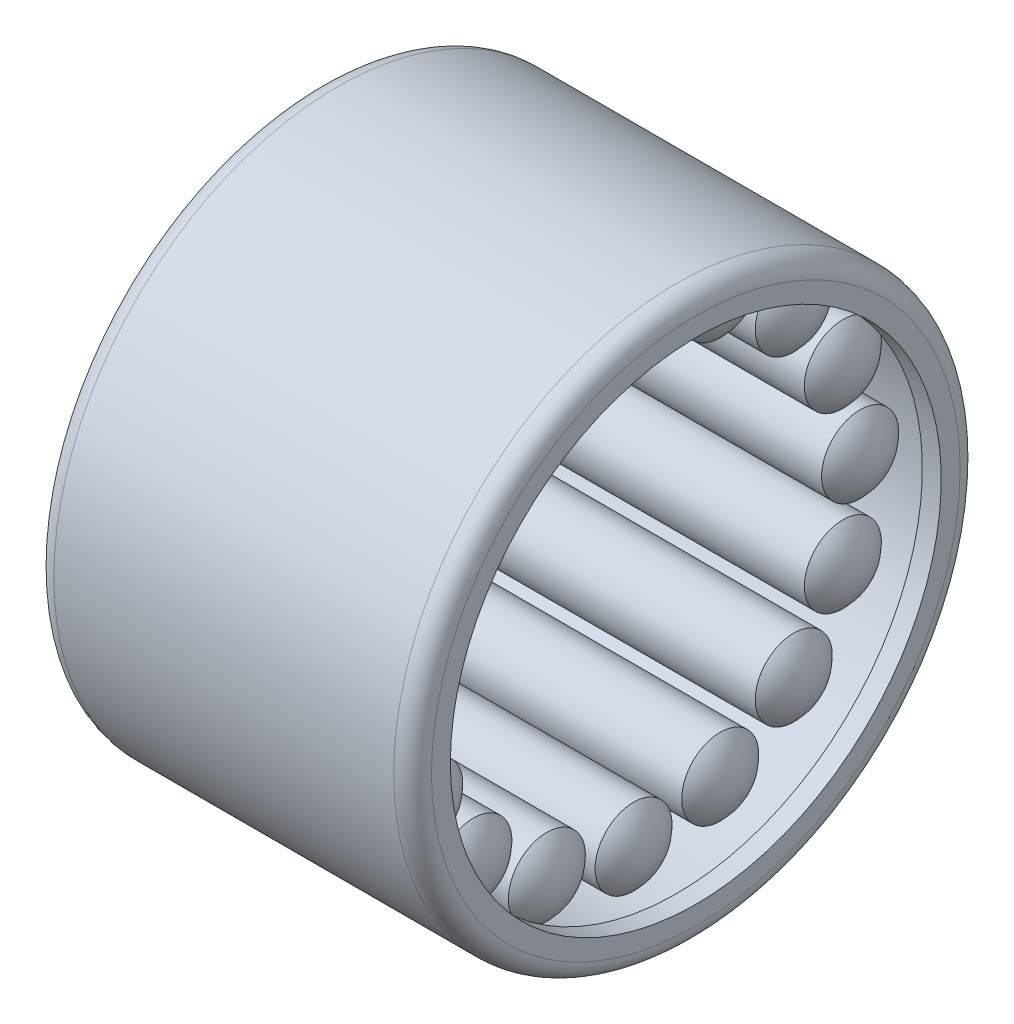
from build123d import *

# Parameters (mm, degrees)
R_P_TITION_CIRCULAIRE1_COUNT = 16


with BuildPart() as part:
    # Esquisse1 → Base-Révolution (revolve)
    with BuildSketch(Plane.XY, mode=Mode.PRIVATE) as base_r_volution_sk:
        with BuildLine():
            Line((0, 0), (0, 1))
            Line((0, 1), (-0.2, 1))
            Line((-0.2, 1), (-0.2, 4))
            Line((-0.2, 4), (0, 4))
            Line((0, 4), (0, 5.5))
            Line((0, 5.5), (-0.2, 5.5))
            Line((-0.2, 5.5), (-0.2, 7))
            ThreePointArc((-0.2, 7), (-0.053553391, 7.353553391), (0.3, 7.5))
            Line((0.3, 7.5), (9.3, 7.5))
            ThreePointArc((9.3, 7.5), (9.653553391, 7.353553391), (9.8, 7))
            Line((9.8, 7), (9.8, 6.5))
            Line((9.8, 6.5), (9.3, 6.5))
            Line((9.3, 6.5), (9.3, 7))
            Line((9.3, 7), (0.3, 7))
            Line((0.3, 7), (0.3, 5.5))
            Line((0.3, 5.5), (0.5, 5.5))
            Line((0.5, 5.5), (0.5, 4))
            Line((0.5, 4), (0.3, 4))
            Line((0.3, 4), (0.3, 1))
            Line((0.3, 1), (0.5, 1))
            Line((0.5, 1), (0.5, 0))
            Line((0.5, 0), (0, 0))
        make_face()
    revolve(base_r_volution_sk.sketch.rotate(Axis((0, 0, 0), (1, 0, 0)), 90), axis=Axis((0, 0, 0), (1, 0, 0)))

    # Esquisse2 → Boss.-Révol.2 (revolve)
    with BuildSketch(Plane.XY):
        with BuildLine():
            Line((1.020408248, 7.02), (8.151164627, 7.02))
            ThreePointArc((8.151164627, 7.02), (8.472601688, 6.554368135), (8.585786438, 6))
            Line((8.585786438, 6), (0.585786438, 6))
            ThreePointArc((0.585786438, 6), (0.698971188, 6.554368135), (1.020408248, 7.02))
        make_face()
    boss_r_vol_2 = revolve(axis=Axis((1, 6, 0), (1, 0, 0)))

    # Répétition circulaire1: Boss.-Révol.2 ×16 about axis
    r_p_tition_circulaire1_axis = Axis((0, 0, 0), (1, 0, 0))
    for i in range(1, R_P_TITION_CIRCULAIRE1_COUNT):
        add(boss_r_vol_2.rotate(r_p_tition_circulaire1_axis, i * 360 / R_P_TITION_CIRCULAIRE1_COUNT))


solid = part.part
